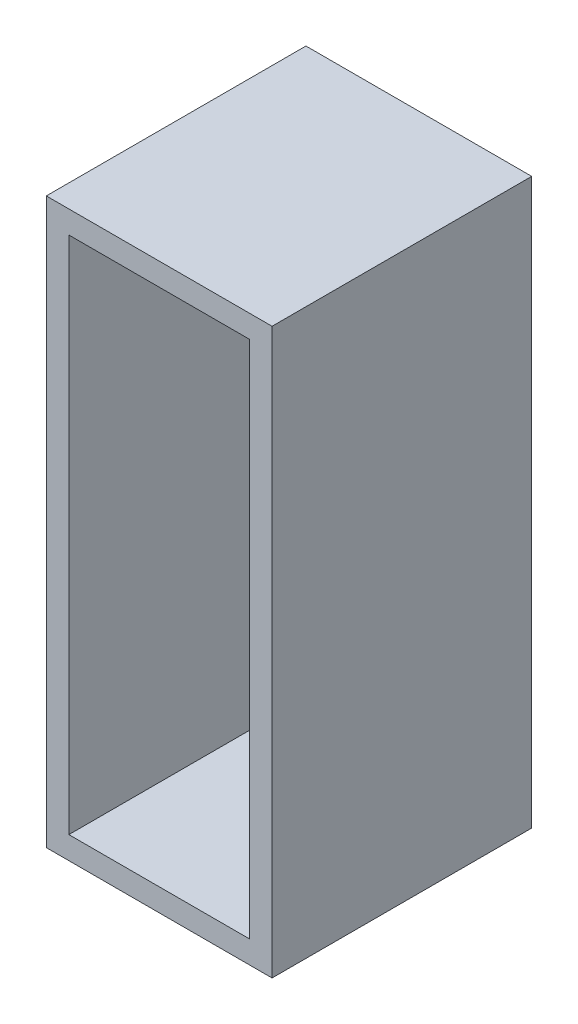
from build123d import *

# Parameters (mm, degrees)
SKETCH2_W           = 20
SKETCH2_H           = 50
BOSS_EXTRUDE1_DEPTH = 23
SKETCH3_W           = 16
SKETCH3_H           = 46
CUT_EXTRUDE1_DEPTH  = 21


with BuildPart() as part:
    # Sketch2 → Boss-Extrude1 (new body)
    with BuildSketch(Plane.XY):
        with Locations((-10, -25)):
            Rectangle(SKETCH2_W, SKETCH2_H)
    extrude(amount=BOSS_EXTRUDE1_DEPTH)

    # Sketch3 → Cut-Extrude1 (cut)
    with BuildSketch(Plane.XY.offset(23)):
        with Locations((-10, -25)):
            Rectangle(SKETCH3_W, SKETCH3_H)
    extrude(amount=-CUT_EXTRUDE1_DEPTH, mode=Mode.SUBTRACT)


solid = part.part
